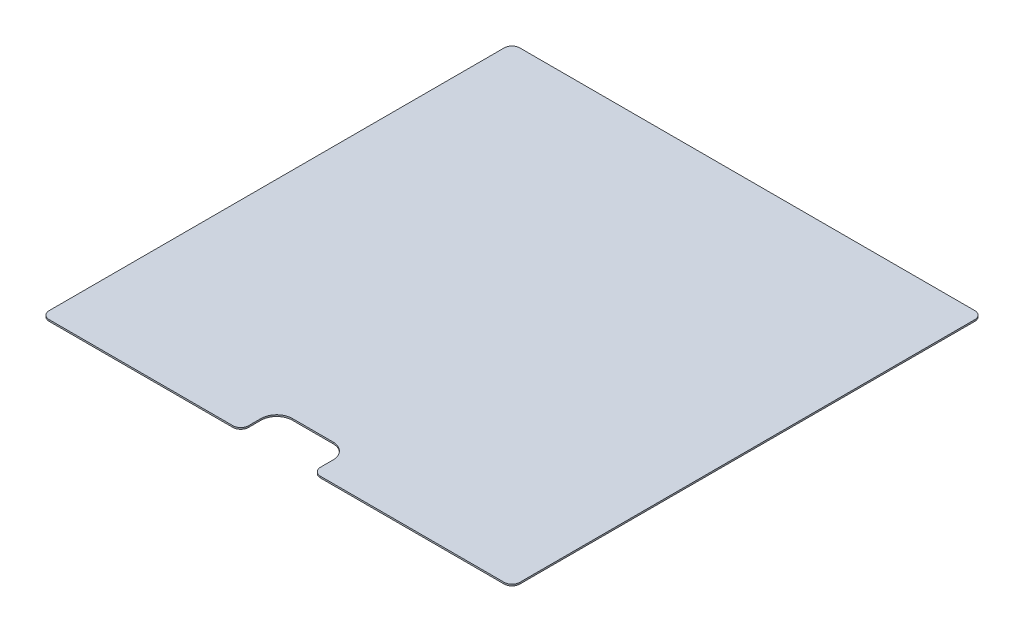
from build123d import *

# Parameters (mm, degrees)
BOSS_EXTRUDE1_DEPTH = 0.05


with BuildPart() as part:
    # Sketch1 → Boss-Extrude1 (new, symmetric)
    with BuildSketch(Plane(origin=(0, 0, 0), x_dir=(1, 0, 0), z_dir=(0, 1, 0))):
        with BuildLine():
            Line((2.2929, -14.5), (2.2929, -13.7071))
            ThreePointArc((2.2929, -13.7071), (2.000006781, -12.999993219), (1.2929, -12.7071))
            Line((1.2929, -12.7071), (-1.2929, -12.7071))
            ThreePointArc((-1.2929, -12.7071), (-2.000006781, -12.999993219), (-2.2929, -13.7071))
            Line((-2.2929, -13.7071), (-2.2929, -14.5))
            ThreePointArc((-2.2929, -14.5), (-2.439346609, -14.853553391), (-2.7929, -15))
            Line((-2.7929, -15), (-14.5, -15))
            ThreePointArc((-14.5, -15), (-14.853553391, -14.853553391), (-15, -14.5))
            Line((-15, -14.5), (-15, 14.5))
            ThreePointArc((-15, 14.5), (-14.853553391, 14.853553391), (-14.5, 15))
            Line((-14.5, 15), (14.5, 15))
            ThreePointArc((14.5, 15), (14.853553391, 14.853553391), (15, 14.5))
            Line((15, 14.5), (15, -14.5))
            ThreePointArc((15, -14.5), (14.853553391, -14.853553391), (14.5, -15))
            Line((14.5, -15), (2.7929, -15))
            ThreePointArc((2.7929, -15), (2.439346609, -14.853553391), (2.2929, -14.5))
        make_face()
    extrude(amount=BOSS_EXTRUDE1_DEPTH, both=True)


solid = part.part
